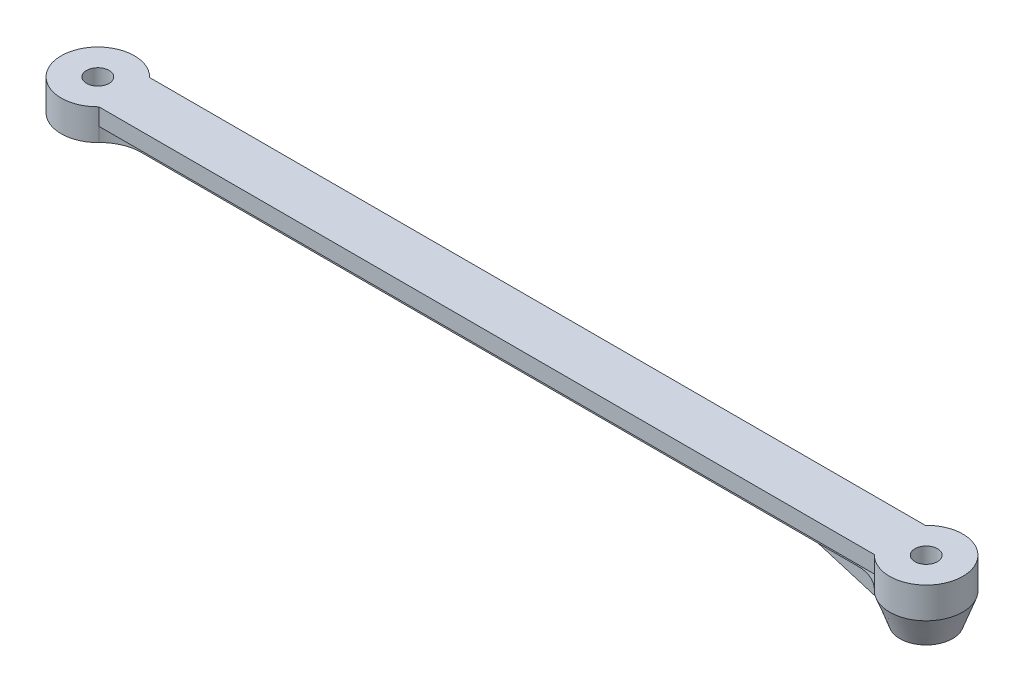
from build123d import *
from build123d.topology import SkipClean

# Parameters (mm, degrees)
SKETCH1_R           = 2
BOSS_EXTRUDE1_DEPTH = 5.5
CUT_EXTRUDE1_DEPTH  = 2.5
SKETCH4_R           = 6.5
SKETCH3_R           = 4.68
SKETCH5_R           = 2
CUT_EXTRUDE2_DEPTH  = 154.995941509
BOSS_EXTRUDE2_DEPTH = 1.25


with BuildPart() as part:
    # Sketch1 → Boss-Extrude1 (new body)
    with BuildSketch(Plane(origin=(0, 0, 0), x_dir=(1, 0, 0), z_dir=(0, 1, 0))):
        with BuildLine():
            Line((-142.30958424, 4.5), (-4.69041576, 4.5))
            ThreePointArc((-4.69041576, 4.5), (6.5, 0), (-4.69041576, -4.5))
            Line((-4.69041576, -4.5), (-142.30958424, -4.5))
            ThreePointArc((-142.30958424, -4.5), (-153.5, 0), (-142.30958424, 4.5))
        make_face()
        with Locations(Location((0, 0, 0), (0, 0, 270))):
            Circle(SKETCH1_R, mode=Mode.SUBTRACT)
        with Locations(Location((-147, 0, 0), (0, 0, 270))):
            Circle(SKETCH1_R, mode=Mode.SUBTRACT)
    extrude(amount=BOSS_EXTRUDE1_DEPTH)

    # Sketch2 → Cut-Extrude1 (cut)
    with BuildSketch(Plane.XZ):
        with BuildLine():
            Line((-9.96713349, 2.25), (-137.03286651, 2.25))
            ThreePointArc((-137.03286651, 2.25), (-139.901064987, 2.835978332), (-142.30958424, 4.5))
            Line((-142.30958424, 4.5), (-4.69041576, 4.5))
            ThreePointArc((-4.69041576, 4.5), (-7.098935013, 2.835978332), (-9.96713349, 2.25))
        make_face()
        with BuildLine():
            Line((-9.96713349, -2.25), (-137.03286651, -2.25))
            ThreePointArc((-137.03286651, -2.25), (-139.901064987, -2.835978332), (-142.30958424, -4.5))
            Line((-142.30958424, -4.5), (-4.69041576, -4.5))
            ThreePointArc((-4.69041576, -4.5), (-7.098935013, -2.835978332), (-9.96713349, -2.25))
        make_face()
    extrude(amount=-CUT_EXTRUDE1_DEPTH, mode=Mode.SUBTRACT)

    # Sketch4 → Loft1 section 0
    with BuildSketch(Plane.XZ):
        Circle(SKETCH4_R)
    # Sketch3 → Loft1 section 1
    with BuildSketch(Plane(origin=(0, -5, 0), x_dir=(-1, 0, 0), z_dir=(0, -1, 0))):
        Circle(SKETCH3_R)
    loft()

    # Sketch5 → Cut-Extrude2 (cut, through all)
    with SkipClean():  # the faces are left unmerged after this step: merging them gives an invalid solid
        with BuildSketch(Plane.XZ.offset(5)):
            with Locations(Location((0, 0, 0), (0, 0, 270))):
                Circle(SKETCH5_R)
        extrude(amount=-CUT_EXTRUDE2_DEPTH, mode=Mode.SUBTRACT)

    # Sketch6 → Boss-Extrude2 (add, symmetric)
    with SkipClean():  # the faces are left unmerged after this step: merging them gives an invalid solid
        with BuildSketch(Plane.XY):
            Polygon((-3.080000032, 0), (-21.280000032, 0), (-4.680000032, -5), (-3.080000032, -5), align=None)
        extrude(amount=BOSS_EXTRUDE2_DEPTH, both=True)


solid = part.part
